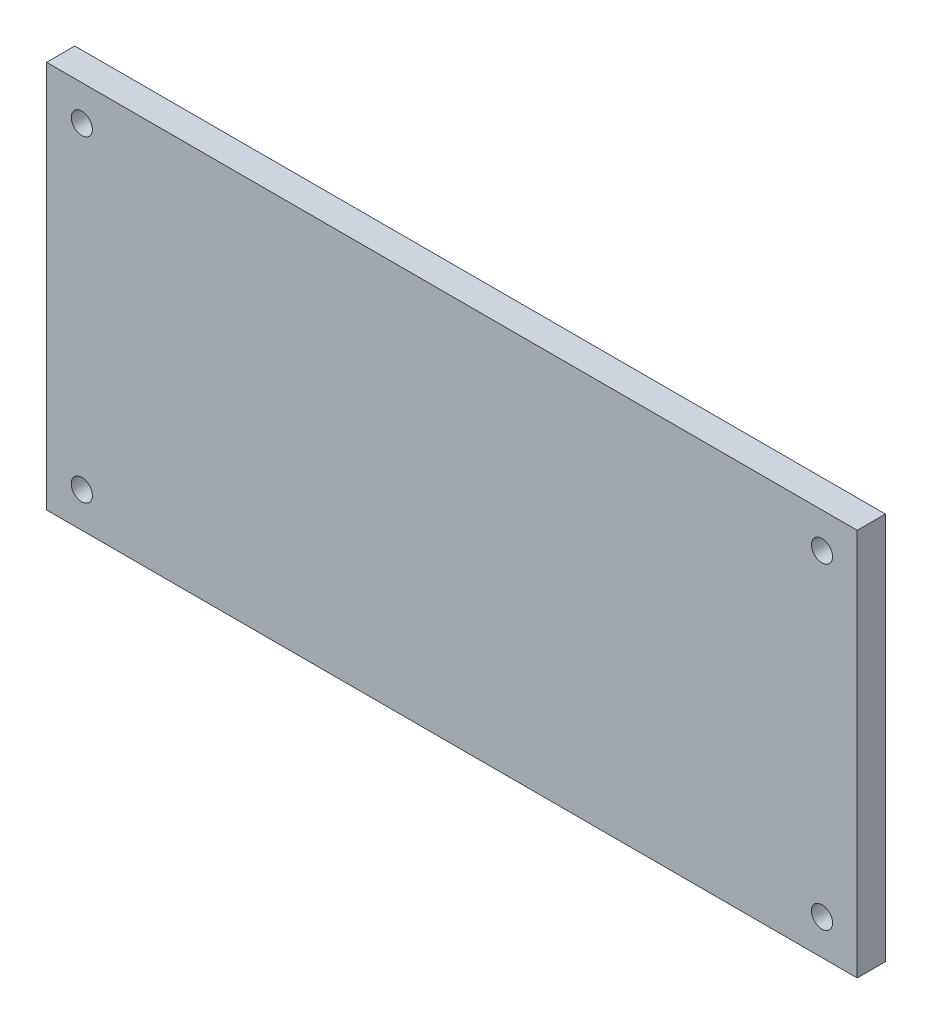
from build123d import *

# Parameters (mm, degrees)
SKETCH_1_W          = 230
SKETCH_1_H          = 110
EXTRUDE_2_DEPTH     = 8
SKETCH_2_R          = 3
CUT_EXTRUDE_1_DEPTH = 8


with BuildPart() as part:
    # 草图1 → 凸台-拉伸2 (new body)
    with BuildSketch(Plane.XY):
        Rectangle(SKETCH_1_W, SKETCH_1_H)
    extrude(amount=EXTRUDE_2_DEPTH)

    # 草图2 → 切除-拉伸1 (cut)
    with BuildSketch(Plane.XY.offset(8)):
        with Locations((-105, 45)):
            Circle(SKETCH_2_R)
        with Locations((-105, -45)):
            Circle(SKETCH_2_R)
        with Locations((105, -45)):
            Circle(SKETCH_2_R)
        with Locations((105, 45)):
            Circle(SKETCH_2_R)
    extrude(amount=-CUT_EXTRUDE_1_DEPTH, mode=Mode.SUBTRACT)


solid = part.part
